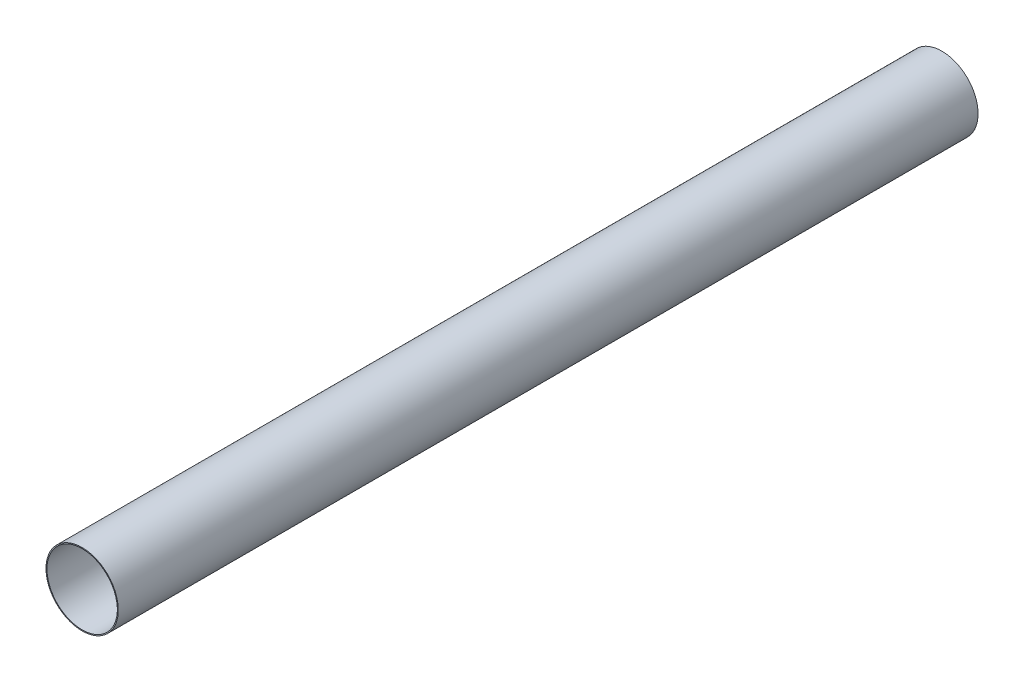
from build123d import *

# Parameters (mm, degrees)
SKETCH1_R           = 75
SKETCH1_R_2         = 73
BOSS_EXTRUDE1_DEPTH = 1784


with BuildPart() as part:
    # Sketch1 → Boss-Extrude1 (new body)
    with BuildSketch(Plane.XY):
        with Locations(Location((0, 0, 0), (0, 0, 180))):
            Circle(SKETCH1_R)
        with Locations(Location((0, 0, 0), (0, 0, 180))):
            Circle(SKETCH1_R_2, mode=Mode.SUBTRACT)
    extrude(amount=BOSS_EXTRUDE1_DEPTH)


solid = part.part
